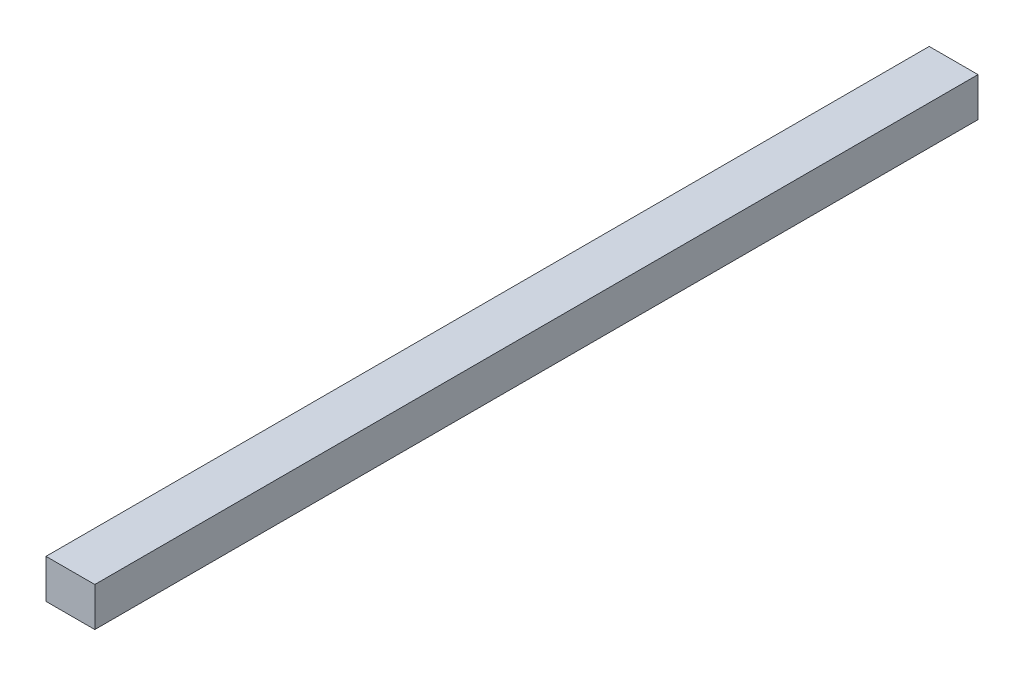
from build123d import *

# Parameters (mm, degrees)
ESQUISSE1_W        = 50
ESQUISSE1_H        = 40
BOSS_EXTRU_1_DEPTH = 905


with BuildPart() as part:
    # Esquisse1 → Boss.-Extru.1 (new body)
    with BuildSketch(Plane.XY):
        with Locations((25, 20)):
            Rectangle(ESQUISSE1_W, ESQUISSE1_H)
    extrude(amount=BOSS_EXTRU_1_DEPTH)


solid = part.part
